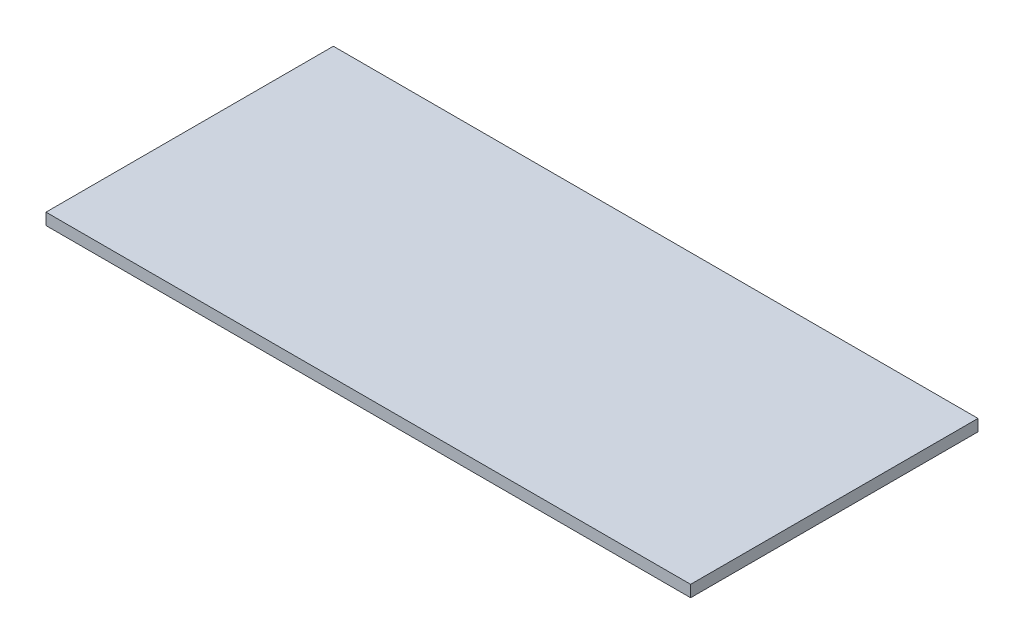
from build123d import *

# Parameters (mm, degrees)
SKETCH1_W           = 1054.1
SKETCH1_H           = 469.9
BOSS_EXTRUDE1_DEPTH = 19.05


with BuildPart() as part:
    # Sketch1 → Boss-Extrude1 (new body)
    with BuildSketch(Plane(origin=(0, 914.4, 0), x_dir=(1, 0, 0), z_dir=(0, 1, 0))):
        with Locations((508, 698.5)):
            Rectangle(SKETCH1_W, SKETCH1_H)
    extrude(amount=BOSS_EXTRUDE1_DEPTH)


solid = part.part
